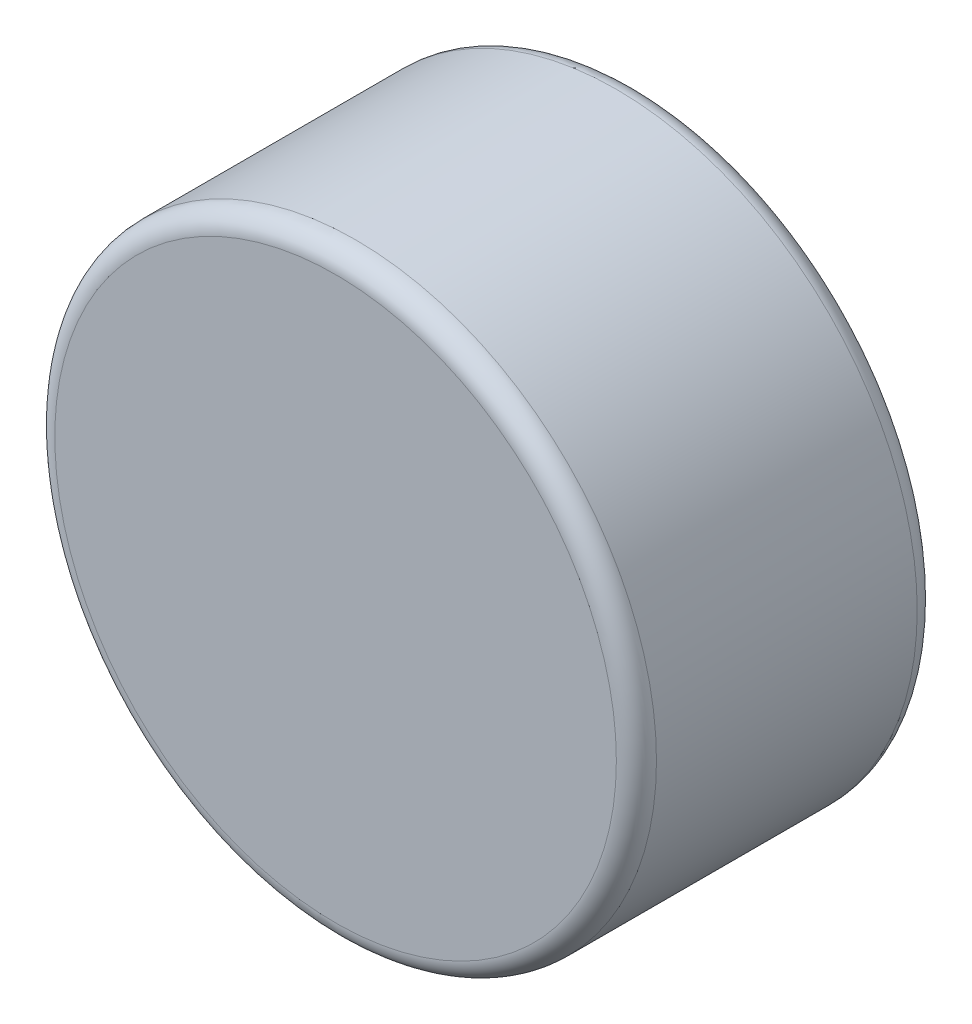
from build123d import *

# Parameters (mm, degrees)
SKETCH_1_R      = 3
EXTRUDE_1_DEPTH = 3
FILLET_1_R      = 0.2


with BuildPart() as part:
    # 草图1 → 凸台-拉伸1 (new body)
    with BuildSketch(Plane.XY):
        Circle(SKETCH_1_R)
    extrude(amount=EXTRUDE_1_DEPTH)

    # 圆角1
    fillet_1_edges = [part.edges().sort_by_distance(p)[0] for p in [
        (-3, 0, 0),
        (-3, 0, 3),
    ]]
    fillet(fillet_1_edges, radius=FILLET_1_R)


solid = part.part
